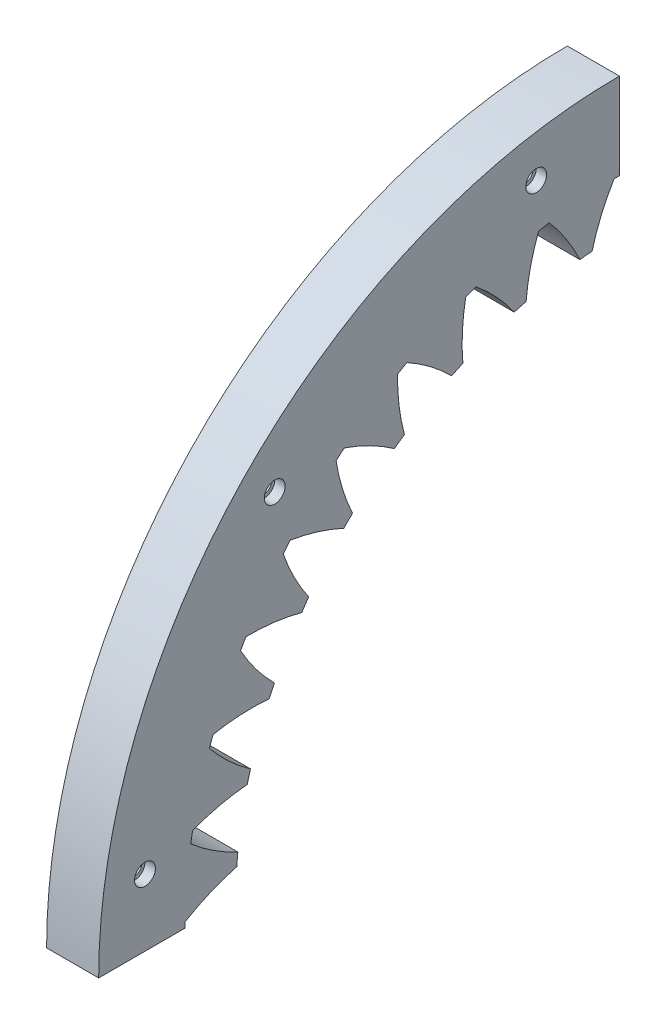
from build123d import *

# Parameters (mm, degrees)
BASPROSKE_W           = 15
BASPROSKE_H           = 39.5
TOOTHCUT_DEPTH        = 213.661703181
TEETHCUTS_COUNT       = 36
TEETHCUTS_ANGLE       = 350
CROQUIS1_OUTSIDE_W    = 386.906
CROQUIS1_OUTSIDE_H    = 386.906
CROQUIS1_OUTSIDE_W_2  = 205.376556513
CROQUIS1_OUTSIDE_H_2  = 174.679952659
CORTAR_EXTRUIR1_DEPTH = 213.661703181
CROQUIS2_R            = 2
CORTAR_EXTRUIR2_DEPTH = 213.661703181
CROQUIS2_3_R          = 3
CROQUIS2_3_R_2        = 2
CORTAR_EXTRUIR3_DEPTH = 3


with BuildPart() as part:
    # BasProSke → Base-Revolve (revolve)
    with BuildSketch(Plane(origin=(0, 0, 0), x_dir=(1, 0, 0), z_dir=(0, 1, 0))):
        with Locations((7.5, 130.25)):
            Rectangle(BASPROSKE_W, BASPROSKE_H)
    revolve(axis=Axis((-10, 0, 0), (1, 0, 0)))

    # TooCutSke → ToothCut (cut, through all)
    with BuildSketch(Plane(origin=(0, 0, 0), x_dir=(0, 0, -1), z_dir=(1, 0, 0))):
        with BuildLine():
            ThreePointArc((7.872935628, 110.193711843), (5.234019781, 117.874768587), (1.556724153, 125.116315826))
            ThreePointArc((1.556724153, 125.116315826), (0, 125.126), (-1.556724153, 125.116315826))
            ThreePointArc((-1.556724153, 125.116315826), (-5.234019781, 117.874768587), (-7.872935628, 110.193711843))
            ThreePointArc((-7.872935628, 110.193711843), (0, 110.4746), (7.872935628, 110.193711843))
        make_face()
    toothcut = extrude(amount=TOOTHCUT_DEPTH, mode=Mode.SUBTRACT)

    # TeethCuts: ToothCut ×36 about axis
    teethcuts_axis = Axis((-10, 0, 0), (1, 0, 0))
    for i in range(1, TEETHCUTS_COUNT):
        add(toothcut.rotate(teethcuts_axis, i * TEETHCUTS_ANGLE / (TEETHCUTS_COUNT - 1)), mode=Mode.SUBTRACT)

    # Croquis1 outside → Cortar-Extruir1 (cut, through all)
    with BuildSketch(Plane(origin=(15, 0, 0), x_dir=(0, 0, -1), z_dir=(1, 0, 0))):
        Rectangle(CROQUIS1_OUTSIDE_W, CROQUIS1_OUTSIDE_H)
        with Locations((-102.688278257, 87.33997633)):
            Rectangle(CROQUIS1_OUTSIDE_W_2, CROQUIS1_OUTSIDE_H_2, mode=Mode.SUBTRACT)
    extrude(amount=-CORTAR_EXTRUIR1_DEPTH, mode=Mode.SUBTRACT)

    # Croquis2 → Cortar-Extruir2 (cut, through all)
    with BuildSketch(Plane(origin=(15, 0, 0), x_dir=(0, 0, -1), z_dir=(1, 0, 0))):
        with Locations((-23.963448518, 135.903469916)):
            Circle(CROQUIS2_R)
        with Locations((-99.268892447, 95.862855123)):
            Circle(CROQUIS2_R)
        with Locations((-136.656993486, 19.205887932)):
            Circle(CROQUIS2_R)
    extrude(amount=-CORTAR_EXTRUIR2_DEPTH, mode=Mode.SUBTRACT)

    # Croquis2<3> → Cortar-Extruir3 (cut)
    # profile 1 of 3: a face of its own
    with BuildSketch(Plane(origin=(15, 0, 0), x_dir=(0, 0, -1), z_dir=(1, 0, 0))):
        with Locations((-23.963448518, 135.903469916)):
            Circle(CROQUIS2_3_R)
        with Locations((-23.963448518, 135.903469916)):
            Circle(CROQUIS2_3_R_2, mode=Mode.SUBTRACT)
    # profile 2 of 3: a face of its own
    with BuildSketch(Plane(origin=(15, 0, 0), x_dir=(0, 0, -1), z_dir=(1, 0, 0))):
        with Locations((-99.268892447, 95.862855123)):
            Circle(CROQUIS2_3_R)
        with Locations((-99.268892447, 95.862855123)):
            Circle(CROQUIS2_3_R_2, mode=Mode.SUBTRACT)
    # profile 3 of 3: a face of its own
    with BuildSketch(Plane(origin=(15, 0, 0), x_dir=(0, 0, -1), z_dir=(1, 0, 0))):
        with Locations((-136.656993486, 19.205887932)):
            Circle(CROQUIS2_3_R)
        with Locations((-136.656993486, 19.205887932)):
            Circle(CROQUIS2_3_R_2, mode=Mode.SUBTRACT)
    extrude(amount=-CORTAR_EXTRUIR3_DEPTH, mode=Mode.SUBTRACT)


solid = part.part
